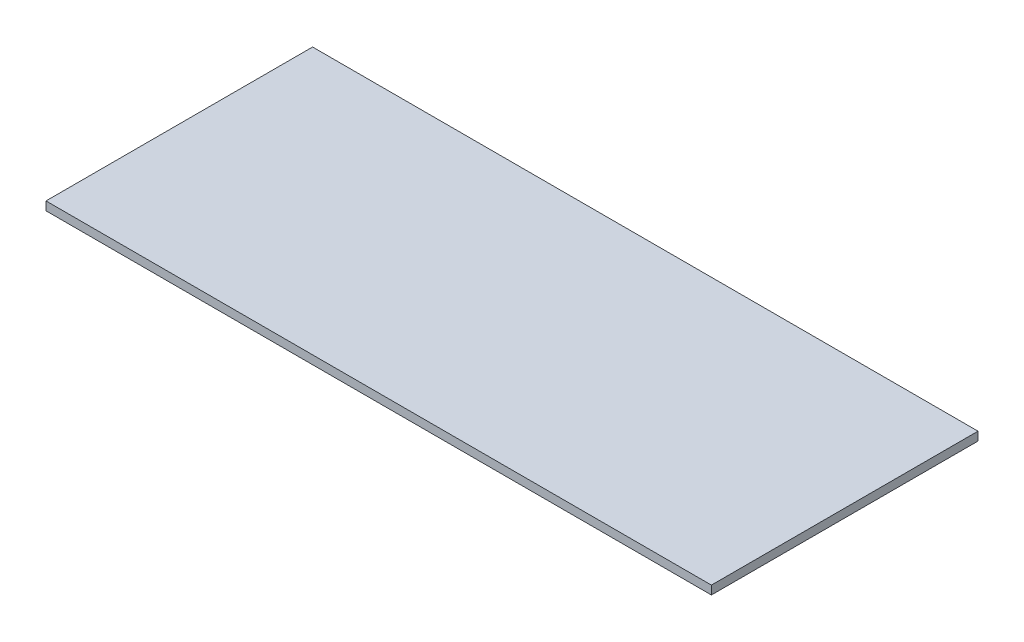
from build123d import *

# Parameters (mm, degrees)
SKETCH1_W           = 393.7
SKETCH1_H           = 157.734
BOSS_EXTRUDE1_DEPTH = 5.08


with BuildPart() as part:
    # Sketch1 → Boss-Extrude1 (new body)
    with BuildSketch(Plane(origin=(0, 0, 0), x_dir=(1, 0, 0), z_dir=(0, 1, 0))):
        Rectangle(SKETCH1_W, SKETCH1_H)
    extrude(amount=BOSS_EXTRUDE1_DEPTH)


solid = part.part
